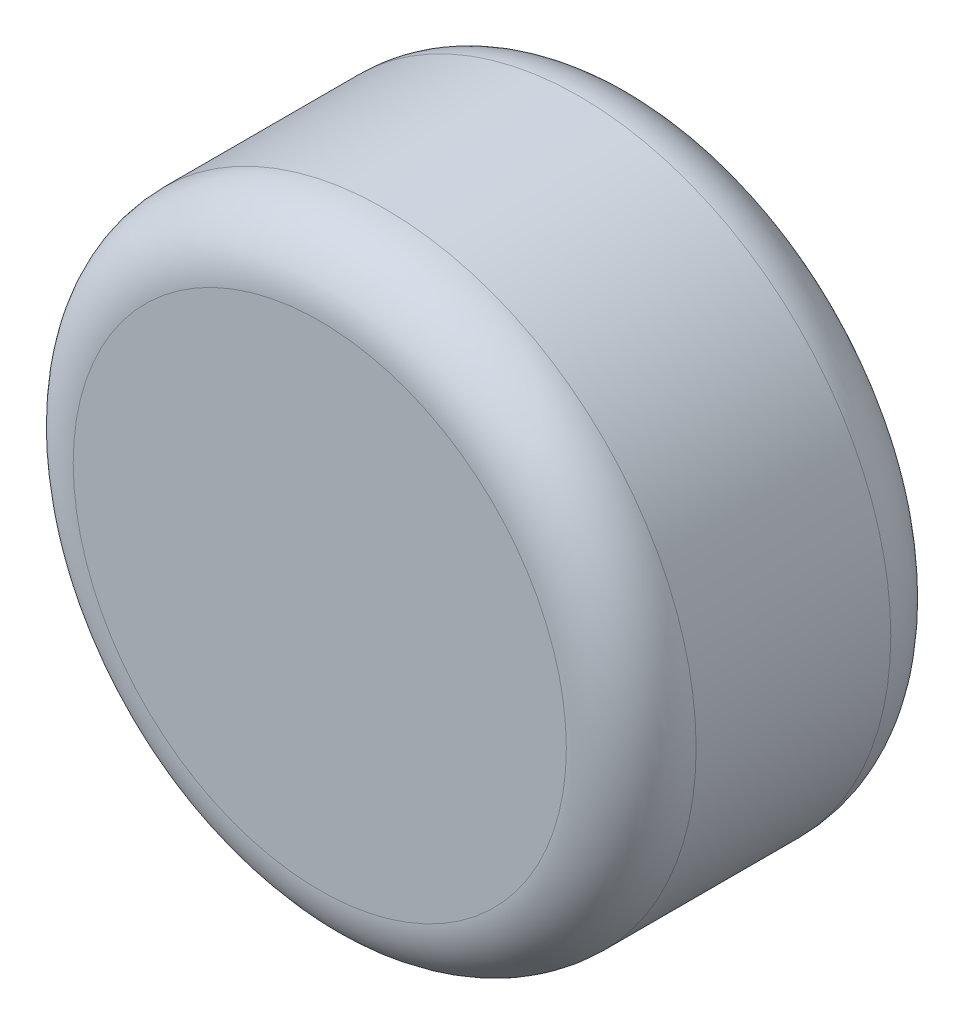
from build123d import *

# Parameters (mm, degrees)
SKETCH_1_R      = 24
EXTRUDE_1_DEPTH = 25
FILLET_1_R      = 5


with BuildPart() as part:
    # ｽｹｯﾁ1 → ﾎﾞｽ - 押し出し1 (new body)
    with BuildSketch(Plane.XY):
        Circle(SKETCH_1_R)
    extrude(amount=EXTRUDE_1_DEPTH)

    # ﾌｨﾚｯﾄ1
    fillet_1_edges = [part.edges().sort_by_distance(p)[0] for p in [
        (-24, 0, 0),
        (-24, 0, 25),
    ]]
    fillet(fillet_1_edges, radius=FILLET_1_R)


solid = part.part
